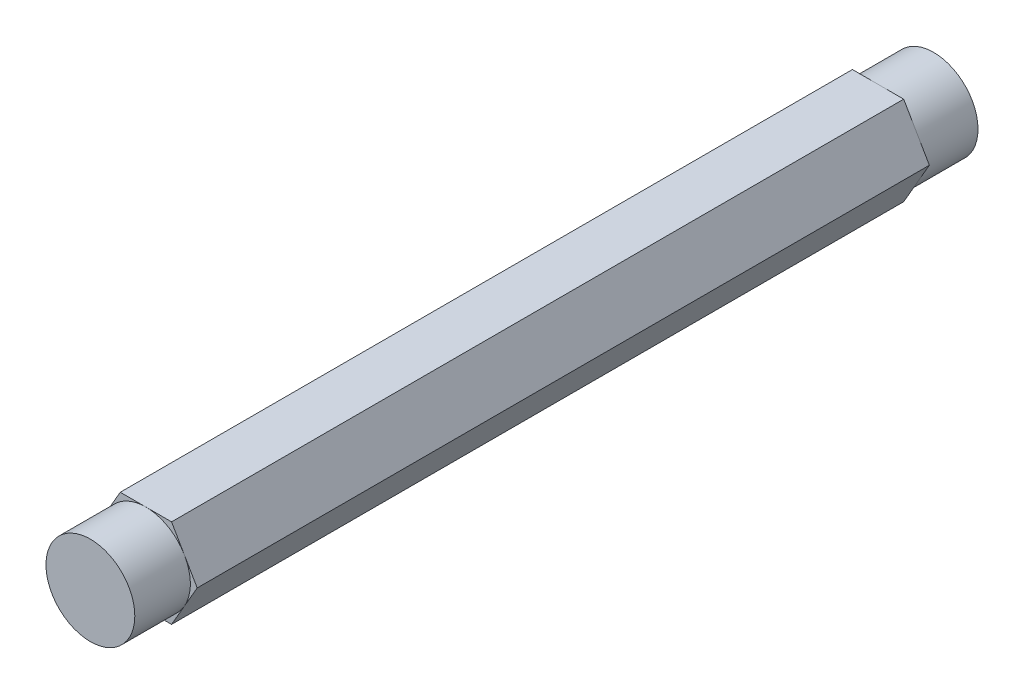
from build123d import *

# Parameters (mm, degrees)
SKETCH1_R           = 6.35
BOSS_EXTRUDE1_DEPTH = 7.9375
BOSS_EXTRUDE2_DEPTH = 104.6734
SKETCH3_R           = 6.35
BOSS_EXTRUDE3_DEPTH = 7.9375


with BuildPart() as part:
    # Sketch1 → Boss-Extrude1 (new body)
    with BuildSketch(Plane.XY):
        Circle(SKETCH1_R)
    extrude(amount=BOSS_EXTRUDE1_DEPTH)

    # Sketch2 → Boss-Extrude2 (add)
    with BuildSketch(Plane.XY.offset(7.9375)):
        Polygon((7.332348419, 0), (3.666174209, 6.35), (-3.666174209, 6.35), (-7.332348419, 0), (-3.666174209, -6.35), (3.666174209, -6.35), align=None)
    extrude(amount=BOSS_EXTRUDE2_DEPTH)

    # Sketch3 → Boss-Extrude3 (add)
    with BuildSketch(Plane.XY.offset(112.6109)):
        with Locations(Location((0, 0, 0), (0, 0, 150))):
            Circle(SKETCH3_R)
    extrude(amount=BOSS_EXTRUDE3_DEPTH)


solid = part.part
